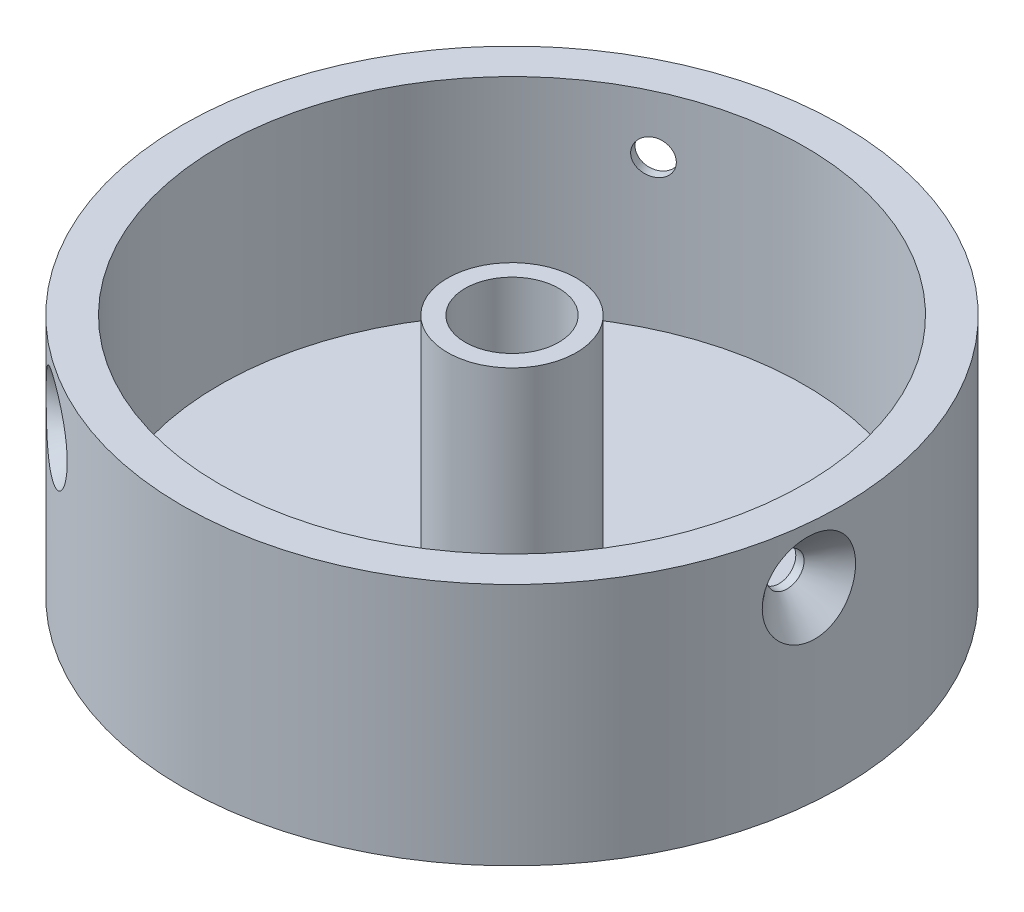
from build123d import *

# Parameters (mm, degrees)
SKETCH1_R                     = 23
BOSS_EXTRUDE1_DEPTH           = 17
SHELL1_T                      = -2.6
SKETCH4_R                     = 4.5
BOSS_EXTRUDE3_DEPTH           = 14.4
SKETCH5_R                     = 3.265
CUT_EXTRUDE2_DEPTH            = 37.701498607
CIRPATTERN1_COUNT             = 3
SKETCH14_R                    = 3
BOSS_EXTRUDE7_DEPTH           = 3
M1_6_TAPPED_HOLE1_D           = 1.25
M1_6_TAPPED_HOLE1_CSINK_D     = 1.65
M1_6_TAPPED_HOLE1_CSINK_ANGLE = 90


with BuildPart() as part:
    # Sketch1 → Boss-Extrude1 (new body)
    with BuildSketch(Plane(origin=(0, 0, 0), x_dir=(1, 0, 0), z_dir=(0, 1, 0))):
        with Locations(Location((0, 0, 0), (0, 0, 270))):
            Circle(SKETCH1_R)
    extrude(amount=BOSS_EXTRUDE1_DEPTH)

    # Shell1
    shell1_openings = [part.faces().sort_by_distance(p)[0] for p in [
        (0, 17, 0),
    ]]
    offset(amount=SHELL1_T, openings=shell1_openings, kind=Kind.INTERSECTION)

    # Sketch4 → Boss-Extrude3 (add)
    with BuildSketch(Plane(origin=(0, 2.6, 0), x_dir=(1, 0, 0), z_dir=(0, 1, 0))):
        with Locations(Location((0, 0, 0), (0, 0, 90))):
            Circle(SKETCH4_R)
    extrude(amount=BOSS_EXTRUDE3_DEPTH)

    # Sketch5 → Cut-Extrude2 (cut, through all)
    with BuildSketch(Plane(origin=(0, 17, 0), x_dir=(1, 0, 0), z_dir=(0, 1, 0))):
        with Locations(Location((0, 0, 0), (0, 0, 270))):
            Circle(SKETCH5_R)
    extrude(amount=-CUT_EXTRUDE2_DEPTH, mode=Mode.SUBTRACT)

    # Sketch9 → CSK SLOT for M2 Countersunk Flat Head Screw1 (revolve, cut)
    with BuildSketch(Plane(origin=(22.911051483, 13, 2.020821599), x_dir=(0.08786180866791495, 0, -0.9961326731804369), z_dir=(0, 1, 0))):
        Polygon((0, 0), (0, 5.721032743), (1.2, 5), (1.2, 2), (3.2, 0), align=None)
    csk_slot_for_m2_countersunk_flat_head_sc = revolve(axis=Axis((29.236493958, 13, 2.578744084), (-0.9961326731804366, 0, -0.08786180866791493)), mode=Mode.SUBTRACT)

    # CirPattern1: CSK SLOT for M2 Countersunk Flat Head Screw1 ×3 about axis
    cirpattern1_axis = Axis((0, 17, 0), (0, -1, 0))
    for i in range(1, CIRPATTERN1_COUNT):
        add(csk_slot_for_m2_countersunk_flat_head_sc.rotate(cirpattern1_axis, i * 360 / CIRPATTERN1_COUNT), mode=Mode.SUBTRACT)

    # Sketch14 → Boss-Extrude7 (add)
    with BuildSketch(Plane(origin=(0, 2.6, 0), x_dir=(1, 0, 0), z_dir=(0, 1, 0))):
        with Locations(Location((3.564798354, -10.406354438, 0), (0, 0, 270))):
            Circle(SKETCH14_R)
    extrude(amount=BOSS_EXTRUDE7_DEPTH)

    # M1.6 Tapped Hole1 (through all)
    with Locations(Plane(origin=(0, 0, 0), x_dir=(-1, 0, 0), z_dir=(0, -1, 0))):
        with Locations((-3.564798354, -10.406354438)):
            CounterSinkHole(M1_6_TAPPED_HOLE1_D / 2, M1_6_TAPPED_HOLE1_CSINK_D / 2, counter_sink_angle=M1_6_TAPPED_HOLE1_CSINK_ANGLE)


solid = part.part
